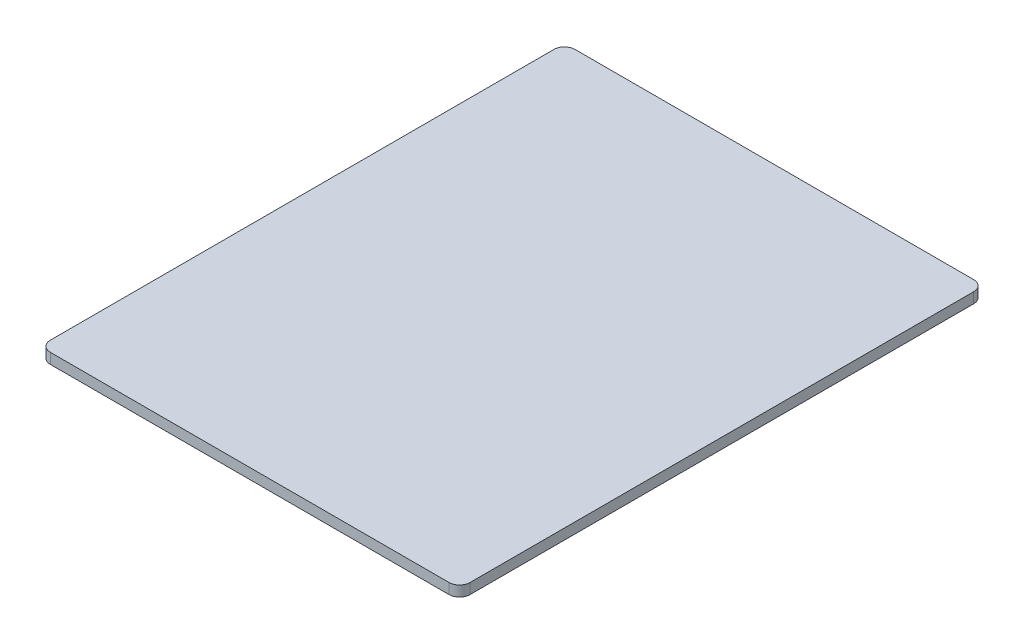
from build123d import *

# Parameters (mm, degrees)
SKETCH1_W           = 400
SKETCH1_H           = 500
BOSS_EXTRUDE1_DEPTH = 10
FILLET1_R           = 10


with BuildPart() as part:
    # Sketch1 → Boss-Extrude1 (new body)
    with BuildSketch(Plane(origin=(0, 0, 0), x_dir=(1, 0, 0), z_dir=(0, 1, 0))):
        with Locations((200, 250)):
            Rectangle(SKETCH1_W, SKETCH1_H)
    extrude(amount=BOSS_EXTRUDE1_DEPTH)

    # Fillet1
    fillet1_edges = [part.edges().sort_by_distance(p)[0] for p in [
        (0, 5, -500),
        (400, 5, -500),
        (400, 5, 0),
        (0, 5, 0),
    ]]
    fillet(fillet1_edges, radius=FILLET1_R)


solid = part.part
